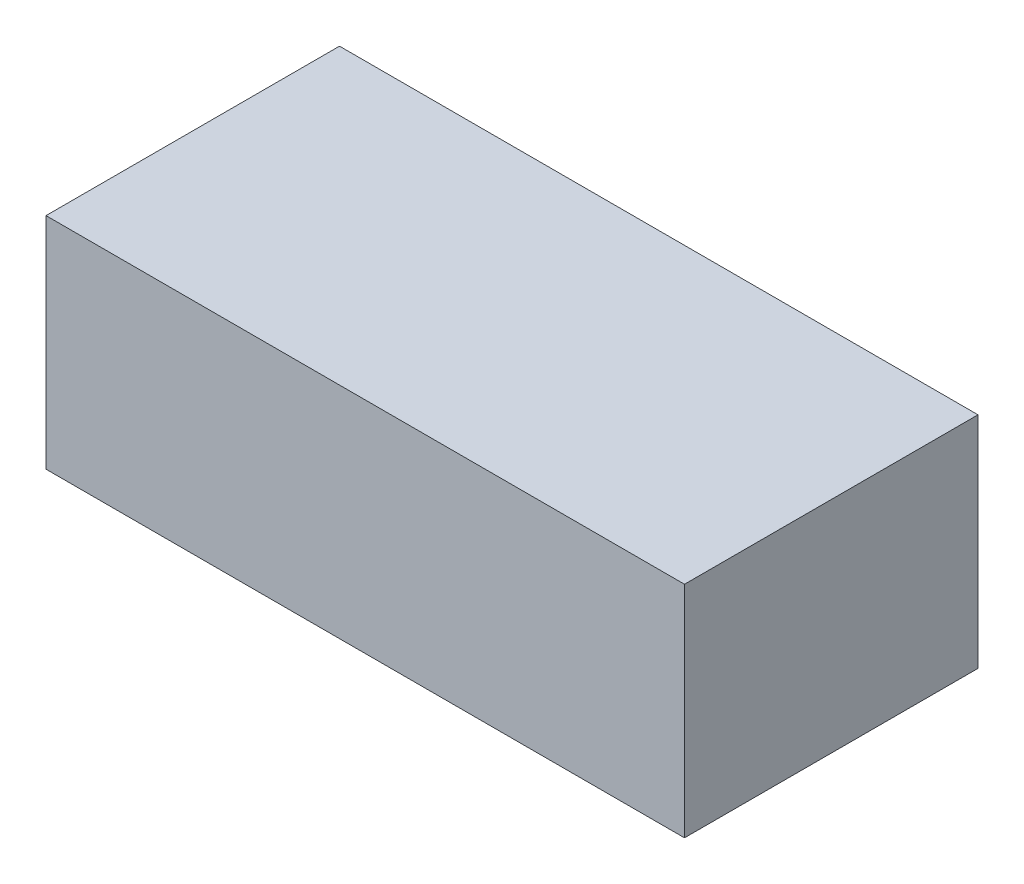
from build123d import *

# Parameters (mm, degrees)
SKETCH1_W           = 65.7
SKETCH1_H           = 30.2
SKETCH1_W_2         = 64.5
SKETCH1_H_2         = 29
BOSS_EXTRUDE1_DEPTH = 22
SKETCH2_W           = 65.7
SKETCH2_H           = 30.2
BOSS_EXTRUDE2_DEPTH = 0.6
SKETCH3_W           = 60
SKETCH3_H           = 15
CUT_EXTRUDE1_DEPTH  = 10.6
CHAMFER1_SIZE       = 1.5


with BuildPart() as part:
    # Sketch1 → Boss-Extrude1 (new body)
    with BuildSketch(Plane(origin=(0, 0, 0), x_dir=(1, 0, 0), z_dir=(0, 1, 0))):
        Rectangle(SKETCH1_W, SKETCH1_H)
        Rectangle(SKETCH1_W_2, SKETCH1_H_2, mode=Mode.SUBTRACT)
    extrude(amount=BOSS_EXTRUDE1_DEPTH)

    # Sketch2 → Boss-Extrude2 (add)
    with BuildSketch(Plane(origin=(0, 22, 0), x_dir=(1, 0, 0), z_dir=(0, 1, 0))):
        Rectangle(SKETCH2_W, SKETCH2_H)
    extrude(amount=BOSS_EXTRUDE2_DEPTH)

    # Sketch3 → Cut-Extrude1 (cut)
    with BuildSketch(Plane(origin=(0, 0, -15.1), x_dir=(-1, 0, 0), z_dir=(0, 0, -1))):
        with Locations((0, 7.5)):
            Rectangle(SKETCH3_W, SKETCH3_H)
    extrude(amount=-CUT_EXTRUDE1_DEPTH, mode=Mode.SUBTRACT)

    # Chamfer1
    chamfer1_edges = [part.edges().sort_by_distance(p)[0] for p in [
        (32.25, 11, 14.5),
        (32.25, 11, -14.5),
        (-32.25, 11, -14.5),
        (-32.25, 11, 14.5),
        (32.25, 22, 0),
        (0, 22, -14.5),
        (-32.25, 22, 0),
        (0, 22, 14.5),
    ]]
    chamfer(chamfer1_edges, length=CHAMFER1_SIZE)


solid = part.part
